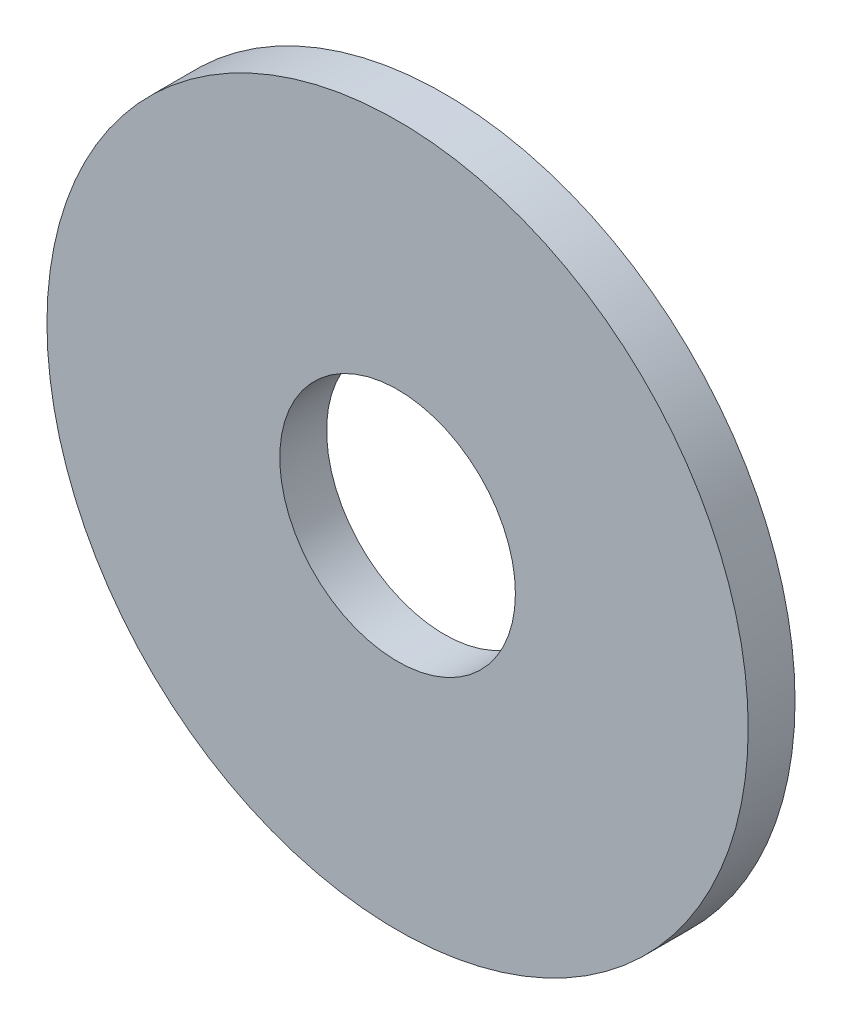
from build123d import *

# Parameters (mm, degrees)
SKETCH_1_R      = 14.97
SKETCH_1_R_2    = 5.03
EXTRUDE_1_DEPTH = 2


with BuildPart() as part:
    # 草图1 → 凸台-拉伸1 (new body)
    with BuildSketch(Plane.XY):
        Circle(SKETCH_1_R)
        Circle(SKETCH_1_R_2, mode=Mode.SUBTRACT)
    extrude(amount=EXTRUDE_1_DEPTH)


solid = part.part
